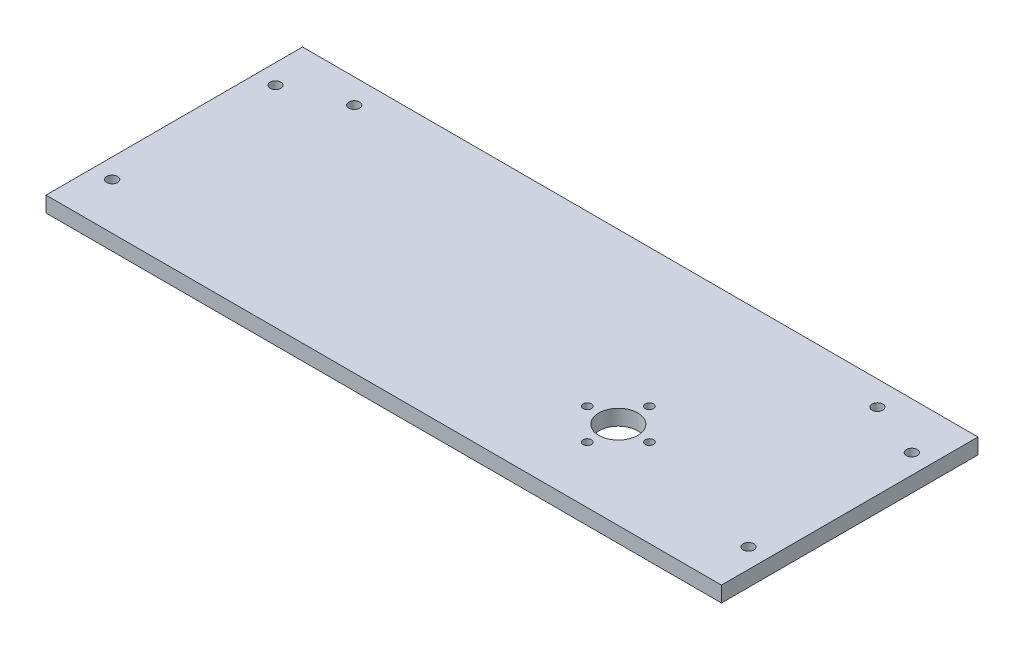
from build123d import *

# Parameters (mm, degrees)
SKETCH1_W           = 276
SKETCH1_H           = 104.826000086
BOSS_EXTRUDE1_DEPTH = 6.35
CUT_EXTRUDE1_REACH  = 149.755
SKETCH2_R           = 2.2
CUT_EXTRUDE2_REACH  = 149.755
SKETCH3_R           = 2.2
CUT_EXTRUDE3_REACH  = 149.755
SKETCH4_R           = 7.9629
CUT_EXTRUDE4_REACH  = 149.755
SKETCH5_R           = 1.7


with BuildPart() as part:
    # Sketch1 → Boss-Extrude1 (new body)
    with BuildSketch(Plane(origin=(0, 0, 0), x_dir=(1, 0, 0), z_dir=(0, 1, 0))):
        Rectangle(SKETCH1_W, SKETCH1_H)
    extrude(amount=BOSS_EXTRUDE1_DEPTH)

    # Sketch2 → Cut-Extrude1 (cut, up to next)
    with BuildSketch(Plane(origin=(0, 6.35, 0), x_dir=(1, 0, 0), z_dir=(0, 1, 0)), mode=Mode.PRIVATE) as cut_extrude1_sk1:
        with Locations(Location((-130, 33.363000043, 0), (0, 0, 270))):
            Circle(SKETCH2_R)
    cut_extrude1_tool1 = extrude(cut_extrude1_sk1.sketch, amount=-CUT_EXTRUDE1_REACH, mode=Mode.PRIVATE) & part.part
    # Sketch2 → Cut-Extrude1 (cut, up to next)
    with BuildSketch(Plane(origin=(0, 6.35, 0), x_dir=(1, 0, 0), z_dir=(0, 1, 0)), mode=Mode.PRIVATE) as cut_extrude1_sk2:
        with Locations(Location((-130, -33.363000043, 0), (0, 0, 270))):
            Circle(SKETCH2_R)
    cut_extrude1_tool2 = extrude(cut_extrude1_sk2.sketch, amount=-CUT_EXTRUDE1_REACH, mode=Mode.PRIVATE) & part.part
    # Sketch2 → Cut-Extrude1 (cut, up to next)
    with BuildSketch(Plane(origin=(0, 6.35, 0), x_dir=(1, 0, 0), z_dir=(0, 1, 0)), mode=Mode.PRIVATE) as cut_extrude1_sk3:
        with Locations(Location((130, -33.363000043, 0), (0, 0, 270))):
            Circle(SKETCH2_R)
    cut_extrude1_tool3 = extrude(cut_extrude1_sk3.sketch, amount=-CUT_EXTRUDE1_REACH, mode=Mode.PRIVATE) & part.part
    # Sketch2 → Cut-Extrude1 (cut, up to next)
    with BuildSketch(Plane(origin=(0, 6.35, 0), x_dir=(1, 0, 0), z_dir=(0, 1, 0)), mode=Mode.PRIVATE) as cut_extrude1_sk4:
        with Locations(Location((130, 33.363000043, 0), (0, 0, 270))):
            Circle(SKETCH2_R)
    cut_extrude1_tool4 = extrude(cut_extrude1_sk4.sketch, amount=-CUT_EXTRUDE1_REACH, mode=Mode.PRIVATE) & part.part
    add(cut_extrude1_tool1.solids().sort_by_distance((-130, 6.35, -33.363))[0], mode=Mode.SUBTRACT)
    add(cut_extrude1_tool2.solids().sort_by_distance((-130, 6.35, 33.363))[0], mode=Mode.SUBTRACT)
    add(cut_extrude1_tool3.solids().sort_by_distance((130, 6.35, 33.363))[0], mode=Mode.SUBTRACT)
    add(cut_extrude1_tool4.solids().sort_by_distance((130, 6.35, -33.363))[0], mode=Mode.SUBTRACT)

    # Sketch3 → Cut-Extrude2 (cut, up to next)
    with BuildSketch(Plane(origin=(0, 6.35, 0), x_dir=(1, 0, 0), z_dir=(0, 1, 0)), mode=Mode.PRIVATE) as cut_extrude2_sk1:
        with Locations(Location((-106.885, 42.413000043, 0), (0, 0, 270))):
            Circle(SKETCH3_R)
    cut_extrude2_tool1 = extrude(cut_extrude2_sk1.sketch, amount=-CUT_EXTRUDE2_REACH, mode=Mode.PRIVATE) & part.part
    # Sketch3 → Cut-Extrude2 (cut, up to next)
    with BuildSketch(Plane(origin=(0, 6.35, 0), x_dir=(1, 0, 0), z_dir=(0, 1, 0)), mode=Mode.PRIVATE) as cut_extrude2_sk2:
        with Locations(Location((106.885, 42.413000043, 0), (0, 0, 270))):
            Circle(SKETCH3_R)
    cut_extrude2_tool2 = extrude(cut_extrude2_sk2.sketch, amount=-CUT_EXTRUDE2_REACH, mode=Mode.PRIVATE) & part.part
    add(cut_extrude2_tool1.solids().sort_by_distance((-106.885, 6.35, -42.413))[0], mode=Mode.SUBTRACT)
    add(cut_extrude2_tool2.solids().sort_by_distance((106.885, 6.35, -42.413))[0], mode=Mode.SUBTRACT)

    # Sketch4 → Cut-Extrude3 (cut, up to next)
    with BuildSketch(Plane(origin=(0, 6.35, 0), x_dir=(1, 0, 0), z_dir=(0, 1, 0)), mode=Mode.PRIVATE) as cut_extrude3_sk1:
        with Locations(Location((60, -16.543000155, 0), (0, 0, 270))):
            Circle(SKETCH4_R)
    cut_extrude3_tool1 = extrude(cut_extrude3_sk1.sketch, amount=-CUT_EXTRUDE3_REACH, mode=Mode.PRIVATE) & part.part
    add(cut_extrude3_tool1.solids().sort_by_distance((60, 6.35, 16.543))[0], mode=Mode.SUBTRACT)

    # Sketch5 → Cut-Extrude4 (cut, up to next)
    with BuildSketch(Plane(origin=(0, 6.35, 0), x_dir=(1, 0, 0), z_dir=(0, 1, 0)), mode=Mode.PRIVATE) as cut_extrude4_sk1:
        with Locations(Location((60, -3.843000155, 0), (0, 0, 270))):
            Circle(SKETCH5_R)
    cut_extrude4_tool1 = extrude(cut_extrude4_sk1.sketch, amount=-CUT_EXTRUDE4_REACH, mode=Mode.PRIVATE) & part.part
    # Sketch5 → Cut-Extrude4 (cut, up to next)
    with BuildSketch(Plane(origin=(0, 6.35, 0), x_dir=(1, 0, 0), z_dir=(0, 1, 0)), mode=Mode.PRIVATE) as cut_extrude4_sk2:
        with Locations(Location((72.7, -16.543000155, 0), (0, 0, 270))):
            Circle(SKETCH5_R)
    cut_extrude4_tool2 = extrude(cut_extrude4_sk2.sketch, amount=-CUT_EXTRUDE4_REACH, mode=Mode.PRIVATE) & part.part
    # Sketch5 → Cut-Extrude4 (cut, up to next)
    with BuildSketch(Plane(origin=(0, 6.35, 0), x_dir=(1, 0, 0), z_dir=(0, 1, 0)), mode=Mode.PRIVATE) as cut_extrude4_sk3:
        with Locations(Location((60, -29.243000155, 0), (0, 0, 270))):
            Circle(SKETCH5_R)
    cut_extrude4_tool3 = extrude(cut_extrude4_sk3.sketch, amount=-CUT_EXTRUDE4_REACH, mode=Mode.PRIVATE) & part.part
    # Sketch5 → Cut-Extrude4 (cut, up to next)
    with BuildSketch(Plane(origin=(0, 6.35, 0), x_dir=(1, 0, 0), z_dir=(0, 1, 0)), mode=Mode.PRIVATE) as cut_extrude4_sk4:
        with Locations(Location((47.3, -16.543000155, 0), (0, 0, 270))):
            Circle(SKETCH5_R)
    cut_extrude4_tool4 = extrude(cut_extrude4_sk4.sketch, amount=-CUT_EXTRUDE4_REACH, mode=Mode.PRIVATE) & part.part
    add(cut_extrude4_tool1.solids().sort_by_distance((60, 6.35, 3.843))[0], mode=Mode.SUBTRACT)
    add(cut_extrude4_tool2.solids().sort_by_distance((72.7, 6.35, 16.543))[0], mode=Mode.SUBTRACT)
    add(cut_extrude4_tool3.solids().sort_by_distance((60, 6.35, 29.243))[0], mode=Mode.SUBTRACT)
    add(cut_extrude4_tool4.solids().sort_by_distance((47.3, 6.35, 16.543))[0], mode=Mode.SUBTRACT)


solid = part.part
